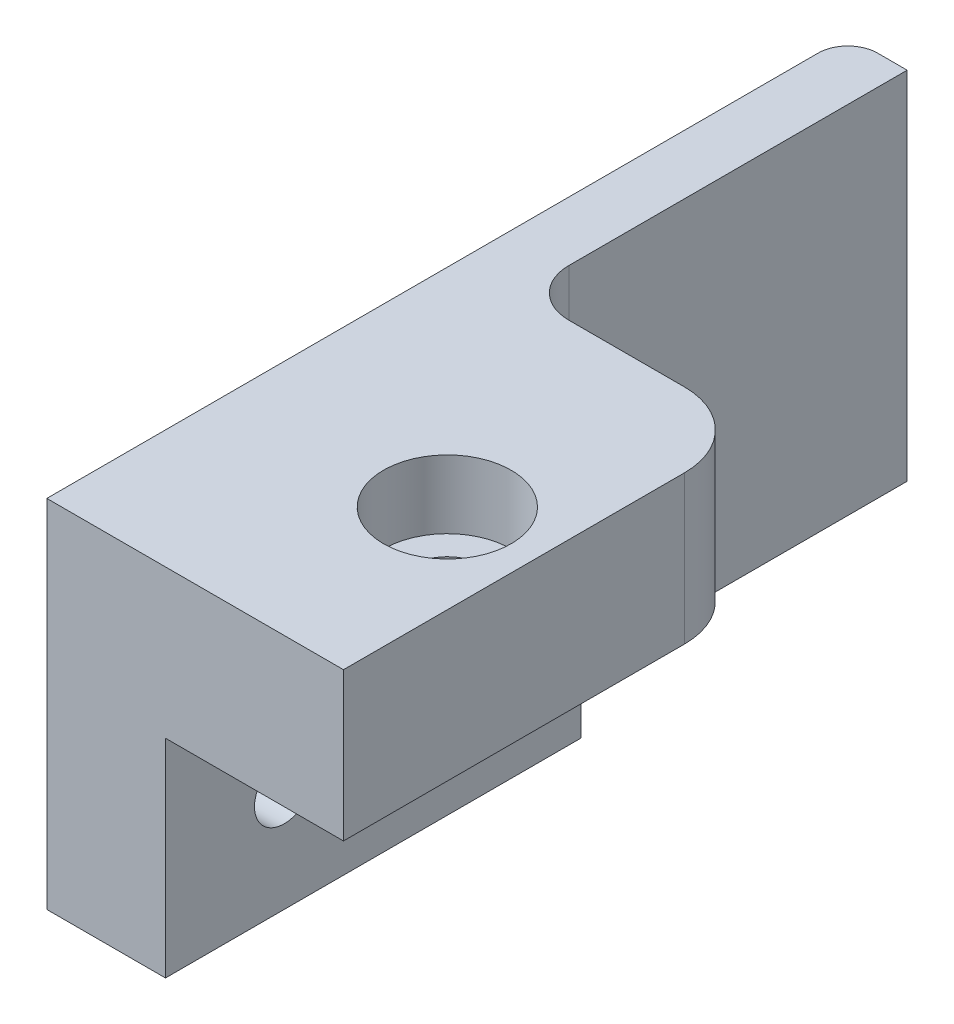
from build123d import *

# Parameters (mm, degrees)
EXTRUDE_1_DEPTH              = 12
SKETCH_2_W                   = 6
SKETCH_2_H                   = 20
CUT_EXTRUDE_1_DEPTH          = 7
F_2_0MM_1_D                  = 2
HOLE_WIZARD_M2_1_D           = 2.4
HOLE_WIZARD_M2_1_CBORE_D     = 4.3
HOLE_WIZARD_M2_1_CBORE_DEPTH = 2.3


with BuildPart() as part:
    # 草图1 → 凸台-拉伸1 (new body)
    with BuildSketch(Plane(origin=(0, 0, 0), x_dir=(1, 0, 0), z_dir=(0, 1, 0))):
        with BuildLine():
            Line((3.6, 14), (7.5, 14))
            ThreePointArc((7.5, 14), (9.267766953, 13.267766953), (10, 11.5))
            Line((10, 11.5), (10, 0))
            Line((10, 0), (0, 0))
            Line((0, 0), (0, 26))
            ThreePointArc((0, 26), (0.292893219, 26.707106781), (1, 27))
            Line((1, 27), (2, 27))
            Line((2, 27), (2, 15.6))
            ThreePointArc((2, 15.6), (2.46862915, 14.46862915), (3.6, 14))
        make_face()
    extrude(amount=EXTRUDE_1_DEPTH)

    # 草图2 → 切除-拉伸1 (cut)
    with BuildSketch(Plane.XZ):
        with Locations((7, -10)):
            Rectangle(SKETCH_2_W, SKETCH_2_H)
    extrude(amount=-CUT_EXTRUDE_1_DEPTH, mode=Mode.SUBTRACT)

    # Ø2.0mm 暗销孔1 (through all)
    with Locations(Plane.ZY):
        with Locations((-4, 3.5), (-9, 3.5)):
            Hole(F_2_0MM_1_D / 2)

    # M2 六角圆柱头螺钉的柱形沉头孔1 (through all)
    with Locations(Plane(origin=(0, 12, 0), x_dir=(1, 0, 0), z_dir=(0, 1, 0))):
        with Locations((7, 6.5)):
            CounterBoreHole(HOLE_WIZARD_M2_1_D / 2, HOLE_WIZARD_M2_1_CBORE_D / 2, HOLE_WIZARD_M2_1_CBORE_DEPTH)


solid = part.part
